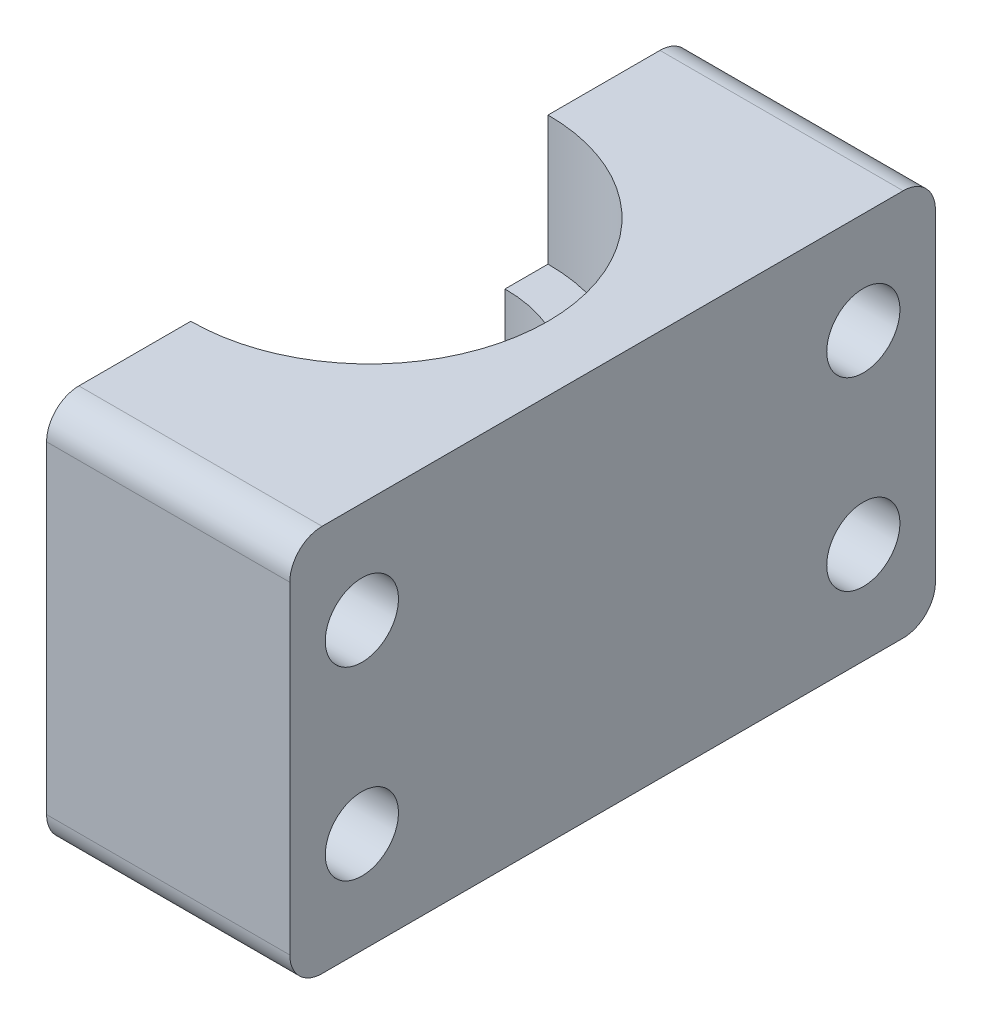
from build123d import *

# Parameters (mm, degrees)
SKETCH8_W           = 30
SKETCH8_H           = 100
BOSS_EXTRUDE1_DEPTH = 100
SKETCH9_W           = 88.7
SKETCH9_H           = 30
CUT_EXTRUDE1_DEPTH  = 103.708324882
SKETCH10_R          = 1.7
CUT_EXTRUDE2_DEPTH  = 21.825225089
FILLET1_R           = 1.5


with BuildPart() as part:
    # Sketch8 → Boss-Extrude1 (new body)
    with BuildSketch(Plane(origin=(0, 0, 0), x_dir=(0, 0, -1), z_dir=(1, 0, 0))):
        Rectangle(SKETCH8_W, SKETCH8_H)
    extrude(amount=BOSS_EXTRUDE1_DEPTH)

    # Sketch7 → Cut-Revolve3 (revolve, cut)
    with BuildSketch(Plane(origin=(0, 0, 0), x_dir=(0, 0, -1), z_dir=(1, 0, 0))):
        Polygon((-8.3, 9), (-150, 9), (-150, 50), (0, 50), (0, -50), (-150, -50), (-150, -9), (-8.3, -9), (-8.3, -3), (-6.3, -3), (-6.3, 3), (-8.3, 3), align=None)
    revolve(axis=Axis((0, -50, 0), (0, 1, 0)), mode=Mode.SUBTRACT)

    # Sketch9 → Cut-Extrude1 (cut, through all)
    with BuildSketch(Plane(origin=(0, 9, 0), x_dir=(1, 0, 0), z_dir=(0, 1, 0))):
        with Locations((55.65, 0)):
            Rectangle(SKETCH9_W, SKETCH9_H)
    extrude(amount=-CUT_EXTRUDE1_DEPTH, mode=Mode.SUBTRACT)

    # Sketch10 → Cut-Extrude2 (cut, through all)
    with BuildSketch(Plane.ZY):
        with Locations((-11.65, 4.3)):
            Circle(SKETCH10_R)
        with Locations((-11.65, -4.3)):
            Circle(SKETCH10_R)
        with Locations((11.65, -4.3)):
            Circle(SKETCH10_R)
        with Locations((11.65, 4.3)):
            Circle(SKETCH10_R)
    extrude(amount=-CUT_EXTRUDE2_DEPTH, mode=Mode.SUBTRACT)

    # Fillet1
    fillet1_edges = [part.edges().sort_by_distance(p)[0] for p in [
        (5.65, 9, 15),
        (5.65, -9, -15),
        (5.65, -9, 15),
        (5.65, 9, -15),
    ]]
    fillet(fillet1_edges, radius=FILLET1_R)


solid = part.part
